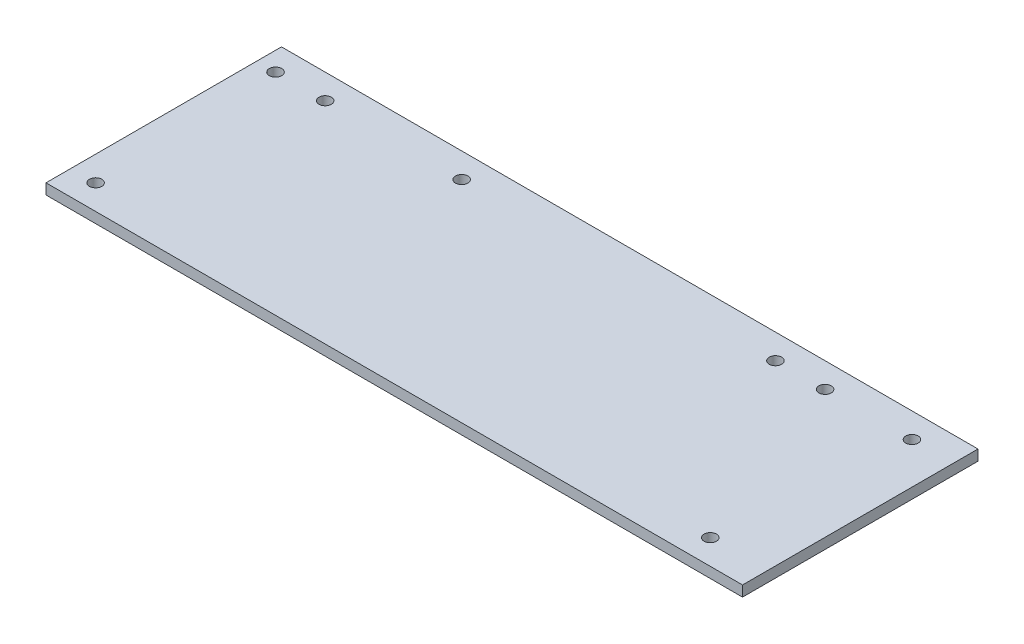
from build123d import *

# Parameters (mm, degrees)
SKETCH1_R           = 3.175
SKETCH1_W           = 25.4
SKETCH1_H           = 95.0722
SKETCH1_W_2         = 5.4102
SKETCH1_H_2         = 12.7
BOSS_EXTRUDE1_DEPTH = 5.4102


with BuildPart() as part:
    # Sketch1 → Boss-Extrude1 (new body)
    # profile 1 of 4: a face of its own
    with BuildSketch(Plane(origin=(0, 0, 0), x_dir=(1, 0, 0), z_dir=(0, 1, 0))):
        Polygon((-165.481, 47.5361), (-165.481, -47.5361), (86.5759, -47.5361), (91.9861, -47.5361), (114.8334, -47.5361), (165.481, -47.5361), (165.481, -42.1259), (165.481, 47.5361), (62.5475, 47.5361), (-73.30694, 47.5361), align=None)
        with Locations(Location((-155.829, 34.8361, 0), (0, 0, 270))):
            Circle(SKETCH1_R, mode=Mode.SUBTRACT)
        with Locations(Location((-86.00694, 34.8361, 0), (0, 0, 270))):
            Circle(SKETCH1_R, mode=Mode.SUBTRACT)
        with Locations(Location((74.549, 34.8361, 0), (0, 0, 270))):
            Circle(SKETCH1_R, mode=Mode.SUBTRACT)
        with Locations(Location((99.949, 34.8361, 0), (0, 0, 270))):
            Circle(SKETCH1_R, mode=Mode.SUBTRACT)
        with Locations(Location((144.399, 34.8361, 0), (0, 0, 270))):
            Circle(SKETCH1_R, mode=Mode.SUBTRACT)
    # profile 2 of 4: a face of its own
    with BuildSketch(Plane(origin=(0, 0, 0), x_dir=(1, 0, 0), z_dir=(0, 1, 0))):
        with Locations((-178.181, 0)):
            Rectangle(SKETCH1_W, SKETCH1_H)
        with Locations(Location((-181.229, 34.8361, 0), (0, 0, 270))):
            Circle(SKETCH1_R, mode=Mode.SUBTRACT)
    # profile 3 of 4: a face of its own
    with BuildSketch(Plane(origin=(0, 0, 0), x_dir=(1, 0, 0), z_dir=(0, 1, 0))):
        Polygon((86.5759, -47.5361), (-165.481, -47.5361), (-190.881, -47.5361), (-190.881, -72.9361), (165.481, -72.9361), (165.481, -47.5361), (114.8334, -47.5361), (91.9861, -47.5361), (91.9861, -60.2361), (86.5759, -60.2361), align=None)
        with Locations(Location((-178.181, -60.2361, 0), (0, 0, 270))):
            Circle(SKETCH1_R, mode=Mode.SUBTRACT)
        with Locations(Location((136.271, -60.2361, 0), (0, 0, 270))):
            Circle(SKETCH1_R, mode=Mode.SUBTRACT)
    # profile 4 of 4: a face of its own
    with BuildSketch(Plane(origin=(0, 0, 0), x_dir=(1, 0, 0), z_dir=(0, 1, 0))):
        with Locations((89.281, -53.8861)):
            Rectangle(SKETCH1_W_2, SKETCH1_H_2)
    extrude(amount=BOSS_EXTRUDE1_DEPTH)


solid = part.part
